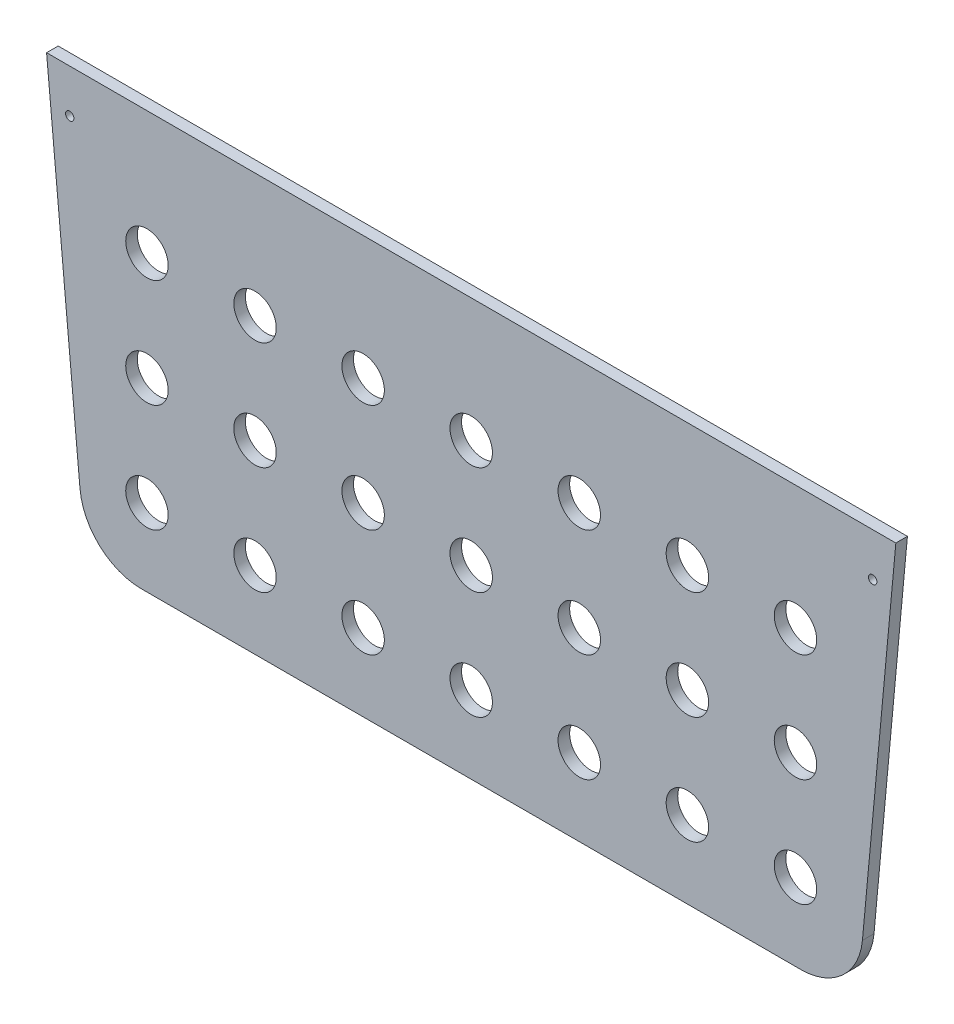
from build123d import *

# Parameters (mm, degrees)
SKETCH1_R                 = 8.73125
BOSS_EXTRUDE1_DEPTH       = 4.7625
TAP_DRILL_FOR_8_32_TAP1_D = 3.4544


with BuildPart() as part:
    # Sketch1 → Boss-Extrude1 (new body)
    with BuildSketch(Plane.XY):
        with BuildLine():
            Line((-174.625, 0), (174.625, 0))
            Line((174.625, 0), (160.88501532, -148.391834548))
            ThreePointArc((160.88501532, -148.391834548), (152.705732731, -164.820223727), (135.593202199, -171.45))
            Line((135.593202199, -171.45), (-135.593202199, -171.45))
            ThreePointArc((-135.593202199, -171.45), (-152.705732731, -164.820223727), (-160.88501532, -148.391834548))
            Line((-160.88501532, -148.391834548), (-174.625, 0))
        make_face()
        with Locations(Location((-44.45, -139.7, 0), (0, 0, 180))):
            Circle(SKETCH1_R, mode=Mode.SUBTRACT)
        with Locations(Location((-88.9, -139.7, 0), (0, 0, 180))):
            Circle(SKETCH1_R, mode=Mode.SUBTRACT)
        with Locations(Location((-133.35, -139.7, 0), (0, 0, 180))):
            Circle(SKETCH1_R, mode=Mode.SUBTRACT)
        with Locations(Location((-88.9, -95.25, 0), (0, 0, 180))):
            Circle(SKETCH1_R, mode=Mode.SUBTRACT)
        with Locations(Location((-133.35, -95.25, 0), (0, 0, 180))):
            Circle(SKETCH1_R, mode=Mode.SUBTRACT)
        with Locations(Location((-88.9, -50.8, 0), (0, 0, 180))):
            Circle(SKETCH1_R, mode=Mode.SUBTRACT)
        with Locations(Location((-133.35, -50.8, 0), (0, 0, 180))):
            Circle(SKETCH1_R, mode=Mode.SUBTRACT)
        with Locations(Location((-44.45, -95.25, 0), (0, 0, 180))):
            Circle(SKETCH1_R, mode=Mode.SUBTRACT)
        with Locations(Location((-44.45, -50.8, 0), (0, 0, 180))):
            Circle(SKETCH1_R, mode=Mode.SUBTRACT)
        with Locations(Location((0, -139.7, 0), (0, 0, 180))):
            Circle(SKETCH1_R, mode=Mode.SUBTRACT)
        with Locations(Location((44.45, -139.7, 0), (0, 0, 180))):
            Circle(SKETCH1_R, mode=Mode.SUBTRACT)
        with Locations(Location((88.9, -139.7, 0), (0, 0, 180))):
            Circle(SKETCH1_R, mode=Mode.SUBTRACT)
        with Locations(Location((133.35, -139.7, 0), (0, 0, 180))):
            Circle(SKETCH1_R, mode=Mode.SUBTRACT)
        with Locations(Location((44.45, -95.25, 0), (0, 0, 180))):
            Circle(SKETCH1_R, mode=Mode.SUBTRACT)
        with Locations(Location((88.9, -95.25, 0), (0, 0, 180))):
            Circle(SKETCH1_R, mode=Mode.SUBTRACT)
        with Locations(Location((133.35, -95.25, 0), (0, 0, 180))):
            Circle(SKETCH1_R, mode=Mode.SUBTRACT)
        with Locations(Location((44.45, -50.8, 0), (0, 0, 180))):
            Circle(SKETCH1_R, mode=Mode.SUBTRACT)
        with Locations(Location((88.9, -50.8, 0), (0, 0, 180))):
            Circle(SKETCH1_R, mode=Mode.SUBTRACT)
        with Locations(Location((133.35, -50.8, 0), (0, 0, 180))):
            Circle(SKETCH1_R, mode=Mode.SUBTRACT)
        with Locations(Location((0, -95.25, 0), (0, 0, 180))):
            Circle(SKETCH1_R, mode=Mode.SUBTRACT)
        with Locations(Location((0, -50.8, 0), (0, 0, 180))):
            Circle(SKETCH1_R, mode=Mode.SUBTRACT)
    extrude(amount=BOSS_EXTRUDE1_DEPTH)

    # Tap Drill for #8-32 Tap1 (through all)
    with Locations(Plane.XY.offset(4.7625)):
        with Locations((165.1, -17.78), (-165.1, -17.78)):
            Hole(TAP_DRILL_FOR_8_32_TAP1_D / 2)


solid = part.part
